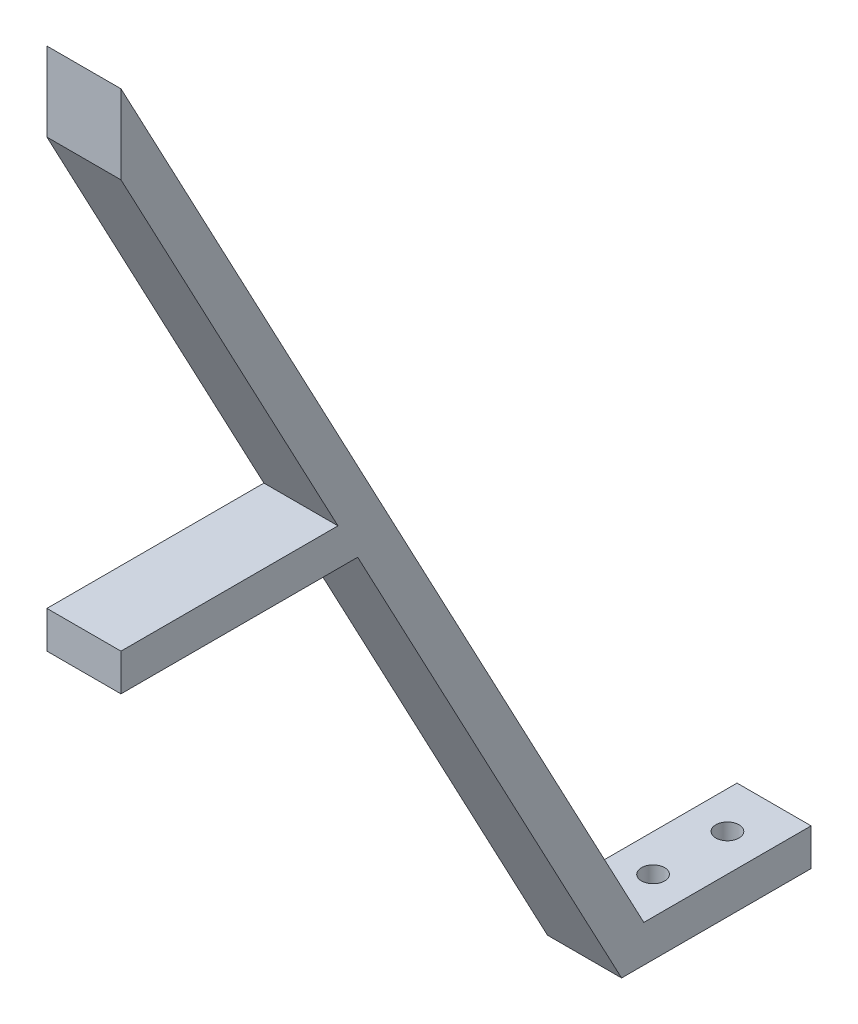
from build123d import *

# Parameters (mm, degrees)
SALIENTE_EXTRUIR1_DEPTH = 50.8
CROQUIS3_R              = 7.9375
CORTAR_EXTRUIR1_DEPTH   = 50.8


with BuildPart() as part:
    # Croquis2 → Saliente-Extruir1 (new body)
    with BuildSketch(Plane(origin=(0, 0, 0), x_dir=(0, 0, -1), z_dir=(1, 0, 0))):
        Polygon((1.620406934, 499.6303555), (360.311589533, -174.9696445), (475.049729809, -174.9696445), (475.049729809, -200.3696445), (345.049729809, -200.3696445), (164.004467363, 140.126972008), (1.620406934, 140.126972008), (1.620406934, 165.526972008), (150.499047799, 165.526972008), (1.620406934, 445.526972008), align=None)
    extrude(amount=SALIENTE_EXTRUIR1_DEPTH)

    # Croquis3 → Cortar-Extruir1 (cut)
    with BuildSketch(Plane(origin=(0, -174.9696445, 0), x_dir=(1, 0, 0), z_dir=(0, 1, 0))):
        with Locations(Location((25.4, 443.049729809, 0), (0, 0, 270))):
            Circle(CROQUIS3_R)
        with Locations(Location((25.4, 392.049729809, 0), (0, 0, 270))):
            Circle(CROQUIS3_R)
    extrude(amount=-CORTAR_EXTRUIR1_DEPTH, mode=Mode.SUBTRACT)


solid = part.part
